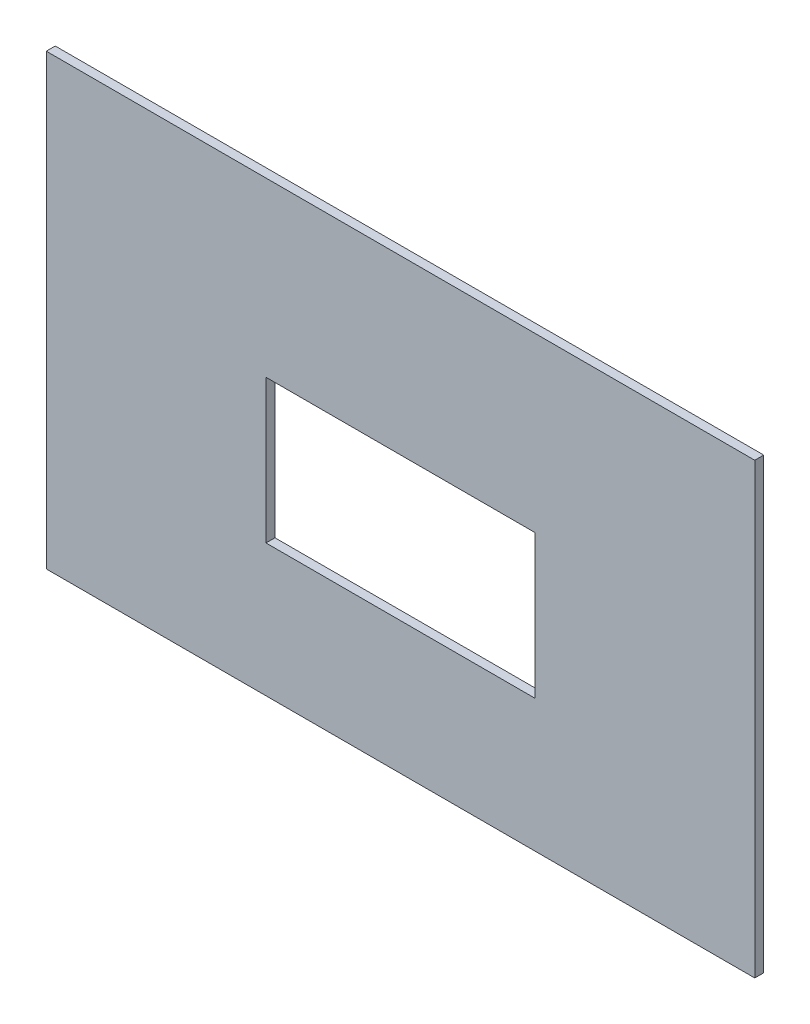
from build123d import *

# Parameters (mm, degrees)
SKETCH1_W           = 790
SKETCH1_H           = 500
BOSS_EXTRUDE1_DEPTH = 10
SKETCH3_W           = 300
SKETCH3_H           = 160
CUT_EXTRUDE1_DEPTH  = 10


with BuildPart() as part:
    # Sketch1 → Boss-Extrude1 (new body)
    with BuildSketch(Plane.XY):
        with Locations((-10.472636816, -54.726368159)):
            Rectangle(SKETCH1_W, SKETCH1_H)
    extrude(amount=BOSS_EXTRUDE1_DEPTH)

    # Sketch3 → Cut-Extrude1 (cut)
    with BuildSketch(Plane(origin=(0, 0, 0), x_dir=(-1, 0, 0), z_dir=(0, 0, -1))):
        with Locations((10.472636816, -77.126368159)):
            Rectangle(SKETCH3_W, SKETCH3_H)
    extrude(amount=-CUT_EXTRUDE1_DEPTH, mode=Mode.SUBTRACT)


solid = part.part
